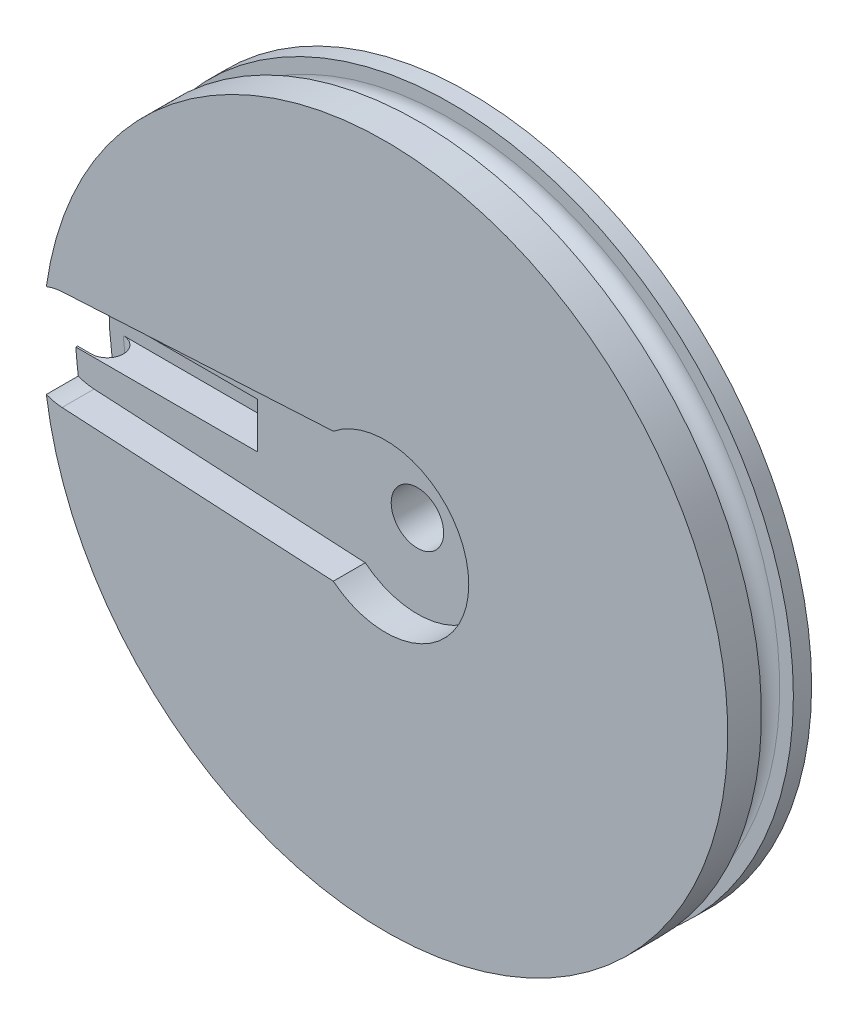
from build123d import *

# Parameters (mm, degrees)
CUT_EXTRUDE1_DEPTH = 1.4
SKETCH5_R          = 1.15
CUT_EXTRUDE2_DEPTH = 22.529180779
CUT_EXTRUDE3_DEPTH = 1.475


with BuildPart() as part:
    # Sketch1 → Revolve1 (revolve)
    with BuildSketch(Plane(origin=(0, 0, 0), x_dir=(0, 0, -1), z_dir=(1, 0, 0)), mode=Mode.PRIVATE) as revolve1_sk:
        with BuildLine():
            Line((-1.8375, 0), (1.8375, 0))
            Line((1.8375, 0), (1.8375, 15))
            Line((1.8375, 15), (1.0375, 15))
            Line((1.0375, 15), (1.0375, 14.4))
            ThreePointArc((1.0375, 14.4), (0.3375, 13.7), (-0.3625, 14.4))
            Line((-0.3625, 14.4), (-0.3625, 15))
            Line((-0.3625, 15), (-1.8375, 15))
            Line((-1.8375, 15), (-1.8375, 0))
        make_face()
    revolve(revolve1_sk.sketch.rotate(Axis((0, 0, 1.8375), (0, 0, -1)), 90), axis=Axis((0, 0, 1.8375), (0, 0, -1)))

    # Sketch2 → Cut-Extrude1 (cut)
    with BuildSketch(Plane.XY.offset(1.8375)):
        with BuildLine():
            Line((-2.285166262, 2.846140396), (-14.170034164, 2.196722968))
            ThreePointArc((-14.170034164, 2.196722968), (-16.25, 0), (-14.170034164, -2.196722968))
            Line((-14.170034164, -2.196722968), (-2.285166262, -2.846140396))
            ThreePointArc((-2.285166262, -2.846140396), (3.65, 0), (-2.285166262, 2.846140396))
        make_face()
    extrude(amount=-CUT_EXTRUDE1_DEPTH, mode=Mode.SUBTRACT)

    # Sketch5 → Cut-Extrude2 (cut, through all)
    with BuildSketch(Plane(origin=(0, 0, -1.8375), x_dir=(-1, 0, 0), z_dir=(0, 0, -1))):
        Circle(SKETCH5_R)
    extrude(amount=-CUT_EXTRUDE2_DEPTH, mode=Mode.SUBTRACT)

    # Sketch6 → Cut-Extrude3 (cut)
    with BuildSketch(Plane.XY.offset(0.4375)):
        with BuildLine():
            Line((-14.966629547, -1), (-7, -1))
            Line((-7, -1), (-7, 1))
            Line((-7, 1), (-14.966629547, 1))
            ThreePointArc((-14.966629547, 1), (-14.991655066, 0.500278293), (-15, -5.3e-08))
            ThreePointArc((-15, -5.3e-08), (-14.991655065, -0.500278346), (-14.966629547, -1))
        make_face()
    extrude(amount=-CUT_EXTRUDE3_DEPTH, mode=Mode.SUBTRACT)


solid = part.part
